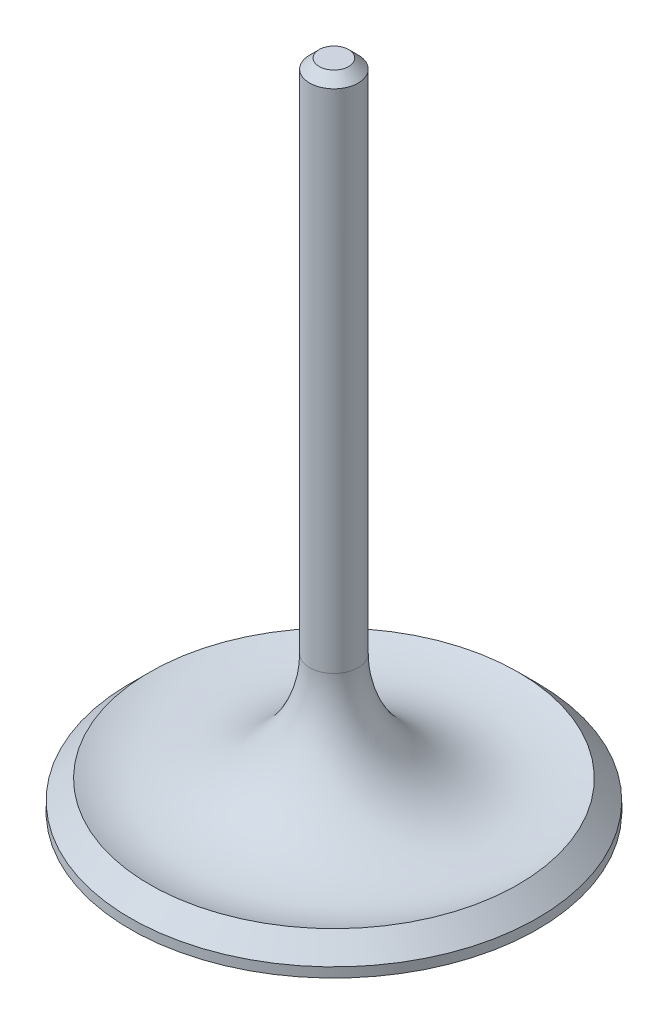
from build123d import *

# Parameters (mm, degrees)
CHAMFER1_SIZE = 1.25


with BuildPart() as part:
    # Sketch1 → Revolve1 (revolve)
    with BuildSketch(Plane.XY, mode=Mode.PRIVATE) as revolve1_sk:
        with BuildLine():
            Line((0, 0), (0, 85.55))
            Line((0, 85.55), (3.18, 85.55))
            Line((3.18, 85.55), (3.18, 17.954698654))
            ThreePointArc((3.18, 17.954698654), (9.896609701, 5.315721242), (24.13, 3.81))
            Line((24.13, 3.81), (26.67, 1.27))
            Line((26.67, 1.27), (26.67, 0))
            Line((26.67, 0), (0, 0))
        make_face()
    revolve(revolve1_sk.sketch.rotate(Axis((0, 0, 0), (0, 1, 0)), 90), axis=Axis((0, 0, 0), (0, 1, 0)))

    # Chamfer1
    chamfer1_edges = [part.edges().sort_by_distance(p)[0] for p in [
        (0, 85.55, 3.18),
    ]]
    chamfer(chamfer1_edges, length=CHAMFER1_SIZE)


solid = part.part
